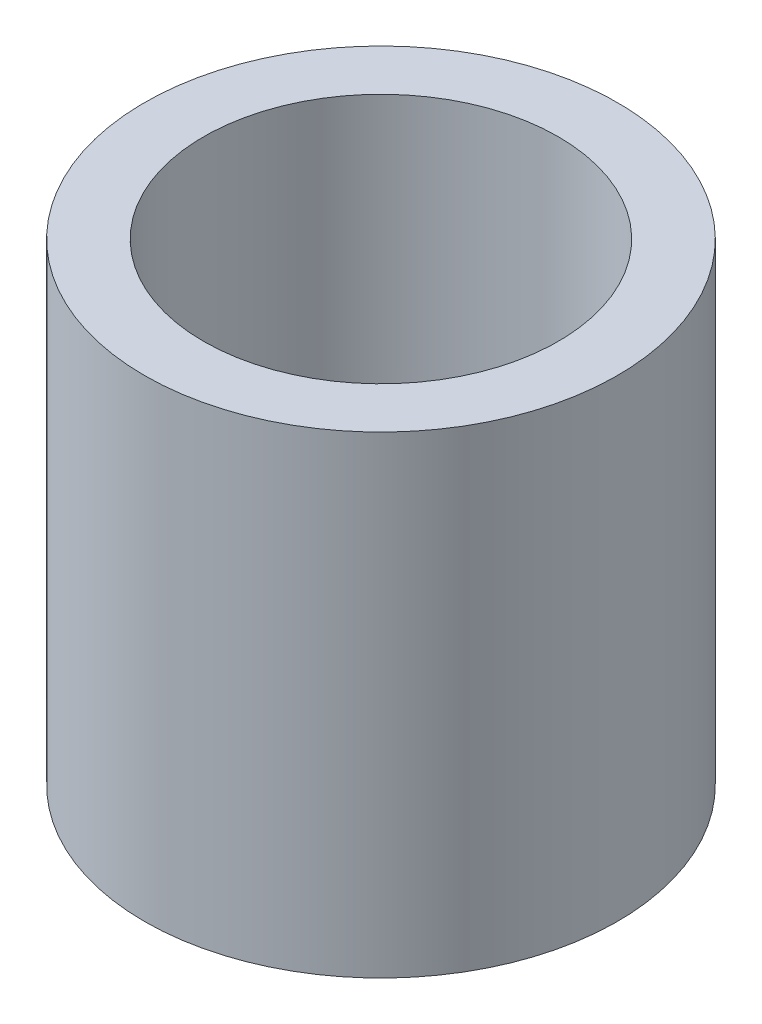
from build123d import *

# Parameters (mm, degrees)
SKETCH1_R           = 4
SKETCH1_R_2         = 3
BOSS_EXTRUDE1_DEPTH = 8


with BuildPart() as part:
    # Sketch1 → Boss-Extrude1 (new body)
    with BuildSketch(Plane(origin=(0, 0, 0), x_dir=(1, 0, 0), z_dir=(0, 1, 0))):
        with Locations(Location((0, 0, 0), (0, 0, 270))):
            Circle(SKETCH1_R)
        with Locations(Location((0, 0, 0), (0, 0, 270))):
            Circle(SKETCH1_R_2, mode=Mode.SUBTRACT)
    extrude(amount=BOSS_EXTRUDE1_DEPTH)


solid = part.part
